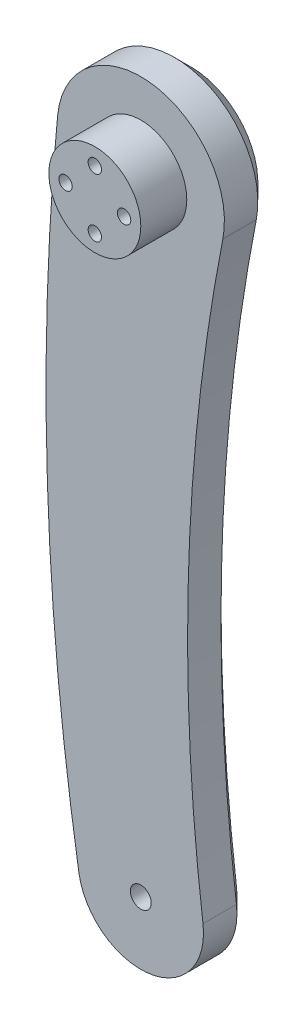
from build123d import *

# Parameters (mm, degrees)
BOSS_EXTRUDE1_DEPTH = 12
CHAMFER1_SIZE       = 4
CUT_EXTRUDE1_REACH  = 168.982
SKETCH2_R           = 1.6
CUT_EXTRUDE2_REACH  = 168.982
SKETCH3_R           = 2.5
BOSS_EXTRUDE2_START = 11
SKETCH4_R           = 11
SKETCH4_R_2         = 1.6
BOSS_EXTRUDE2_DEPTH = 11
SKETCH5_R           = 2.5
CUT_EXTRUDE3_DEPTH  = 18


with BuildPart() as part:
    # Sketch1 → Boss-Extrude1 (new body)
    with BuildSketch(Plane.XY):
        with BuildLine():
            ThreePointArc((-14.803345861, -152.420940171), (2.169116424, -164.842335865), (14.877042343, -148.083333333))
            ThreePointArc((14.877042343, -148.083333333), (11.431951297, -75.777407981), (19.625034581, -3.854609929))
            ThreePointArc((19.625034581, -3.854609929), (2.889103385, 19.790226922), (-19.907947882, 1.916666667))
            ThreePointArc((-19.907947882, 1.916666667), (-22.341608419, -75.417043737), (-14.803345861, -152.420940171))
        make_face()
    extrude(amount=BOSS_EXTRUDE1_DEPTH)

    # Chamfer1
    chamfer1_edges = [part.edges().sort_by_distance(p)[0] for p in [
        (2.889103385, 19.790226922, 0),
        (11.431951297, -75.777407981, 0),
        (2.169116424, -164.842335865, 0),
        (-22.341608419, -75.417043737, 0),
    ]]
    chamfer(chamfer1_edges, length=CHAMFER1_SIZE)

    # Sketch2 → Cut-Extrude1 (cut, up to next)
    with BuildSketch(Plane.XY.offset(12), mode=Mode.PRIVATE) as cut_extrude1_sk1:
        with Locations((0, 7)):
            Circle(SKETCH2_R)
    cut_extrude1_tool1 = extrude(cut_extrude1_sk1.sketch, amount=-CUT_EXTRUDE1_REACH, mode=Mode.PRIVATE) & part.part
    # Sketch2 → Cut-Extrude1 (cut, up to next)
    with BuildSketch(Plane.XY.offset(12), mode=Mode.PRIVATE) as cut_extrude1_sk2:
        with Locations((7, 0)):
            Circle(SKETCH2_R)
    cut_extrude1_tool2 = extrude(cut_extrude1_sk2.sketch, amount=-CUT_EXTRUDE1_REACH, mode=Mode.PRIVATE) & part.part
    # Sketch2 → Cut-Extrude1 (cut, up to next)
    with BuildSketch(Plane.XY.offset(12), mode=Mode.PRIVATE) as cut_extrude1_sk3:
        with Locations((0, -7)):
            Circle(SKETCH2_R)
    cut_extrude1_tool3 = extrude(cut_extrude1_sk3.sketch, amount=-CUT_EXTRUDE1_REACH, mode=Mode.PRIVATE) & part.part
    # Sketch2 → Cut-Extrude1 (cut, up to next)
    with BuildSketch(Plane.XY.offset(12), mode=Mode.PRIVATE) as cut_extrude1_sk4:
        with Locations((-7, 0)):
            Circle(SKETCH2_R)
    cut_extrude1_tool4 = extrude(cut_extrude1_sk4.sketch, amount=-CUT_EXTRUDE1_REACH, mode=Mode.PRIVATE) & part.part
    add(cut_extrude1_tool1.solids().sort_by_distance((0, 7, 12))[0], mode=Mode.SUBTRACT)
    add(cut_extrude1_tool2.solids().sort_by_distance((7, 0, 12))[0], mode=Mode.SUBTRACT)
    add(cut_extrude1_tool3.solids().sort_by_distance((0, -7, 12))[0], mode=Mode.SUBTRACT)
    add(cut_extrude1_tool4.solids().sort_by_distance((-7, 0, 12))[0], mode=Mode.SUBTRACT)

    # Sketch3 → Cut-Extrude2 (cut, up to next)
    with BuildSketch(Plane.XY.offset(12), mode=Mode.PRIVATE) as cut_extrude2_sk1:
        with Locations((0, -150)):
            Circle(SKETCH3_R)
    cut_extrude2_tool1 = extrude(cut_extrude2_sk1.sketch, amount=-CUT_EXTRUDE2_REACH, mode=Mode.PRIVATE) & part.part
    add(cut_extrude2_tool1.solids().sort_by_distance((0, -150, 12))[0], mode=Mode.SUBTRACT)

    # Sketch4 → Boss-Extrude2 (add)
    with BuildSketch(Plane.XY.offset(12).offset(BOSS_EXTRUDE2_START)):
        Circle(SKETCH4_R)
        with Locations((7, 0)):
            Circle(SKETCH4_R_2, mode=Mode.SUBTRACT)
        with Locations((0, -7)):
            Circle(SKETCH4_R_2, mode=Mode.SUBTRACT)
        with Locations((-7, 0)):
            Circle(SKETCH4_R_2, mode=Mode.SUBTRACT)
        with Locations((0, 7)):
            Circle(SKETCH4_R_2, mode=Mode.SUBTRACT)
    extrude(amount=-BOSS_EXTRUDE2_DEPTH)

    # Sketch5 → Cut-Extrude3 (cut)
    with BuildSketch(Plane(origin=(0, 0, 0), x_dir=(-1, 0, 0), z_dir=(0, 0, -1))):
        with Locations((0, 7)):
            Circle(SKETCH5_R)
        with Locations((7, 0)):
            Circle(SKETCH5_R)
        with Locations((0, -7)):
            Circle(SKETCH5_R)
        with Locations((-7, 0)):
            Circle(SKETCH5_R)
    extrude(amount=-CUT_EXTRUDE3_DEPTH, mode=Mode.SUBTRACT)


solid = part.part
